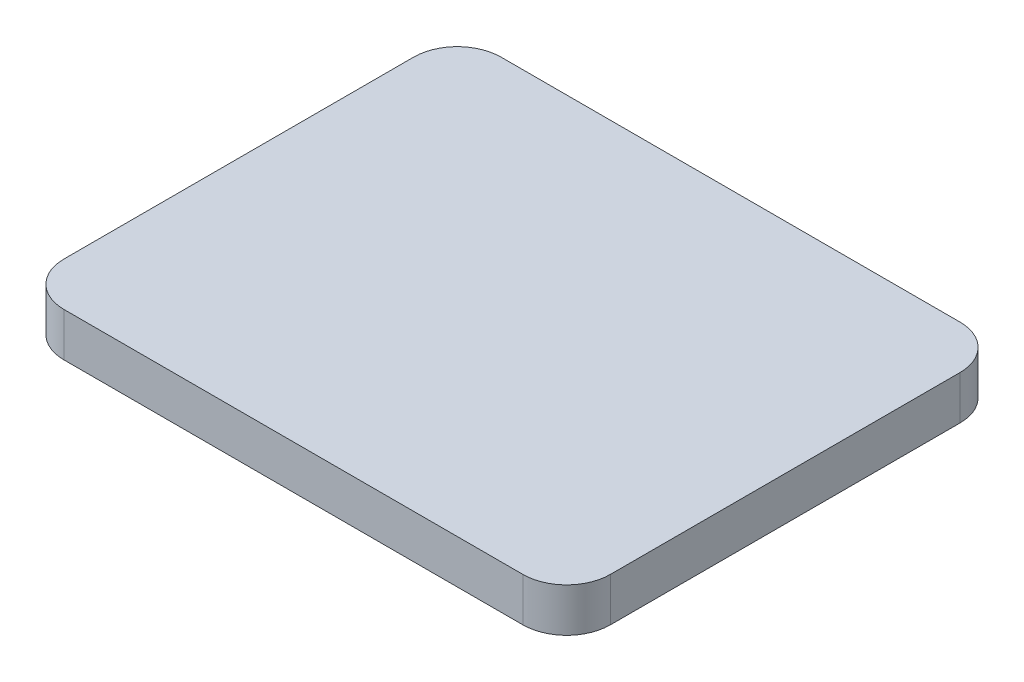
from build123d import *

# Parameters (mm, degrees)
SKETCH1_W           = 31.75
SKETCH1_H           = 25.4
BOSS_EXTRUDE1_DEPTH = 2.54
FILLET1_R           = 2.54


with BuildPart() as part:
    # Sketch1 → Boss-Extrude1 (new body)
    with BuildSketch(Plane(origin=(0, 0, 0), x_dir=(1, 0, 0), z_dir=(0, 1, 0))):
        Rectangle(SKETCH1_W, SKETCH1_H)
    extrude(amount=BOSS_EXTRUDE1_DEPTH)

    # Fillet1
    fillet1_edges = [part.edges().sort_by_distance(p)[0] for p in [
        (-15.875, 1.27, -12.7),
        (15.875, 1.27, -12.7),
        (15.875, 1.27, 12.7),
        (-15.875, 1.27, 12.7),
    ]]
    fillet(fillet1_edges, radius=FILLET1_R)


solid = part.part
